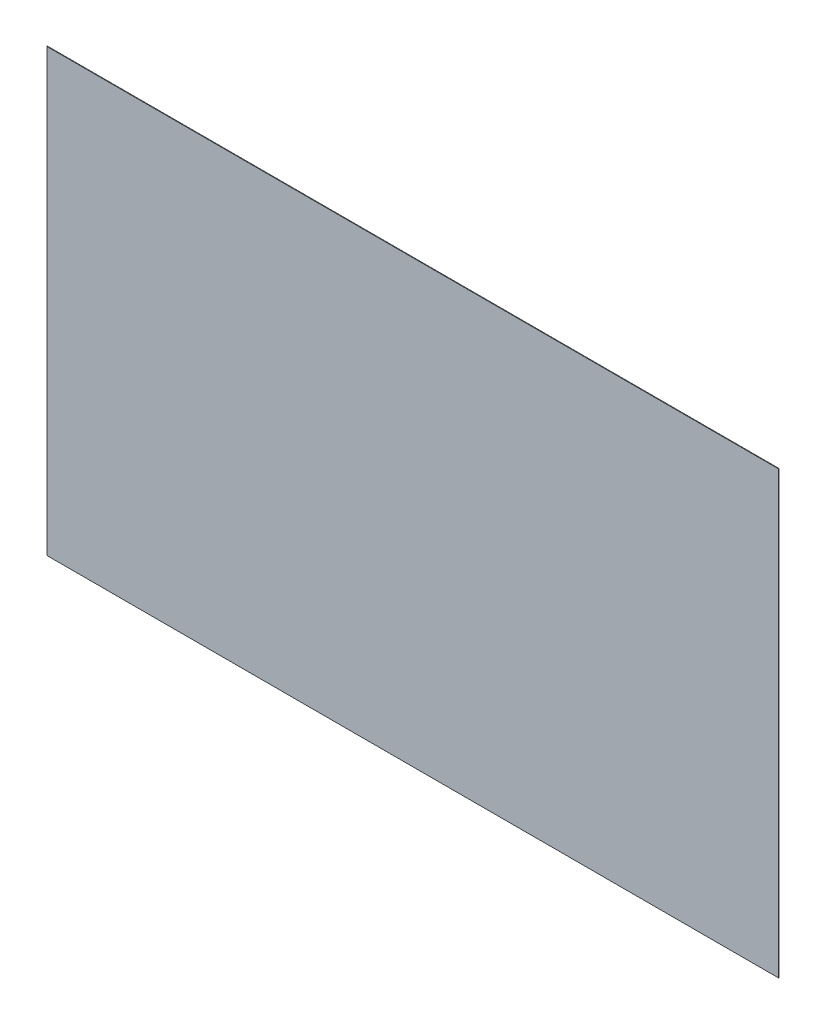
from build123d import *

# Parameters (mm, degrees)
SKETCH1_W           = 2500
SKETCH1_H           = 1506
BOSS_EXTRUDE1_DEPTH = 2


with BuildPart() as part:
    # Sketch1 → Boss-Extrude1 (new body)
    with BuildSketch(Plane.XY):
        with Locations((1250, 753)):
            Rectangle(SKETCH1_W, SKETCH1_H)
    extrude(amount=BOSS_EXTRUDE1_DEPTH)


solid = part.part
